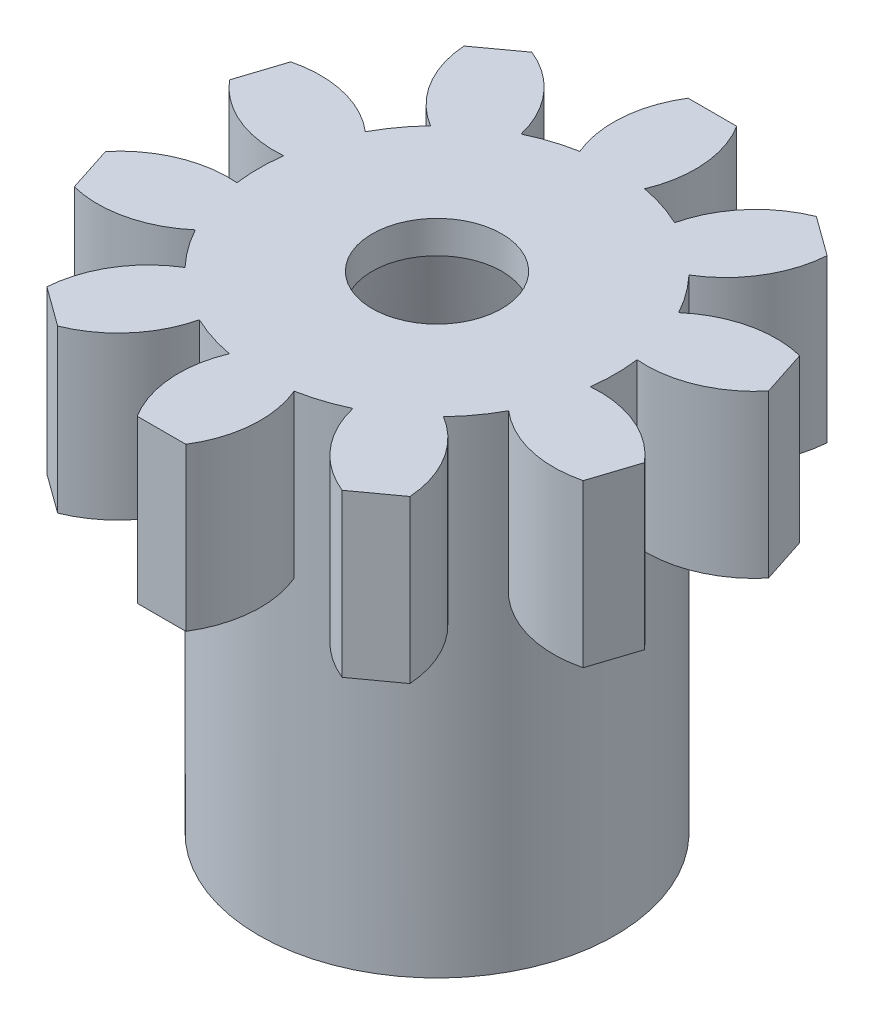
from build123d import *
from build123d.topology import SkipClean

# Parameters (mm, degrees)
SKETCH_1_R      = 5.5
EXTRUDE_1_DEPTH = 5
EXTRUDE_START   = -5
EXTRUDE_2_DEPTH = 5
EXTRUDE_START_2 = 10
SKETCH_3_R      = 5.5
EXTRUDE_3_DEPTH = 10


with BuildPart() as part:
    # 草图1 → 凸台-拉伸1 (new body)
    with BuildSketch(Plane(origin=(0, 0, 0), x_dir=(1, 0, 0), z_dir=(0, 1, 0))):
        with Locations(Location((0, 0, 0), (0, 0, 270))):
            Circle(SKETCH_1_R)
    extrude(amount=EXTRUDE_1_DEPTH)

    # 草图2 → 凸台-拉伸2 (add)
    with BuildSketch(Plane(origin=(0, 5, 0), x_dir=(-1, 0, 0), z_dir=(0, 1, 0)).offset(EXTRUDE_START)):
        with BuildLine():
            Line((-4.389411899, -7.317483391), (-5.60293739, -6.435805513))
            ThreePointArc((-5.60293739, -6.435805513), (-5.11774735, -4.915167527), (-3.987951794, -3.787643132))
            ThreePointArc((-3.987951794, -3.787643132), (-3.232818888, -4.449593469), (-2.369917805, -4.963213636))
            ThreePointArc((-2.369917805, -4.963213636), (-3.093131201, -6.386137262), (-4.389411899, -7.317483391))
        make_face()
        with BuildLine():
            Line((-7.852217643, -3.339936839), (-8.315743134, -1.913352065))
            ThreePointArc((-8.315743134, -1.913352065), (-7.029407564, -0.968317642), (-5.452641547, -0.720208411))
            ThreePointArc((-5.452641547, -0.720208411), (-5.23081084, -1.699593469), (-4.834607559, -2.622321444))
            ThreePointArc((-4.834607559, -2.622321444), (-6.256073009, -3.34839667), (-7.852217643, -3.339936839))
        make_face()
        with BuildLine():
            Line((-8.315743134, 1.913352065), (-7.852217643, 3.339936839))
            ThreePointArc((-7.852217643, 3.339936839), (-6.256073009, 3.34839667), (-4.834607559, 2.622321444))
            ThreePointArc((-4.834607559, 2.622321444), (-5.23081084, 1.699593469), (-5.452641547, 0.720208411))
            ThreePointArc((-5.452641547, 0.720208411), (-7.029407564, 0.968317642), (-8.315743134, 1.913352065))
        make_face()
        with BuildLine():
            Line((-5.60293739, 6.435805513), (-4.389411899, 7.317483391))
            ThreePointArc((-4.389411899, 7.317483391), (-3.093131201, 6.386137262), (-2.369917805, 4.963213636))
            ThreePointArc((-2.369917805, 4.963213636), (-3.232818888, 4.449593469), (-3.987951794, 3.787643132))
            ThreePointArc((-3.987951794, 3.787643132), (-5.11774735, 4.915167527), (-5.60293739, 6.435805513))
        make_face()
        with BuildLine():
            Line((-0.75, 8.5), (0.75, 8.5))
            ThreePointArc((0.75, 8.5), (1.251281594, 6.984590476), (1, 5.408326913))
            ThreePointArc((1, 5.408326913), (0, 5.5), (-1, 5.408326913))
            ThreePointArc((-1, 5.408326913), (-1.251281594, 6.984590476), (-0.75, 8.5))
        make_face()
        with BuildLine():
            Line((4.389411899, 7.317483391), (5.60293739, 6.435805513))
            ThreePointArc((5.60293739, 6.435805513), (5.11774735, 4.915167527), (3.987951794, 3.787643132))
            ThreePointArc((3.987951794, 3.787643132), (3.232818888, 4.449593469), (2.369917805, 4.963213636))
            ThreePointArc((2.369917805, 4.963213636), (3.093131201, 6.386137262), (4.389411899, 7.317483391))
        make_face()
        with BuildLine():
            Line((0.75, -8.5), (-0.75, -8.5))
            ThreePointArc((-0.75, -8.5), (-1.251281594, -6.984590476), (-1, -5.408326913))
            ThreePointArc((-1, -5.408326913), (0, -5.5), (1, -5.408326913))
            ThreePointArc((1, -5.408326913), (1.251281594, -6.984590476), (0.75, -8.5))
        make_face()
        with BuildLine():
            Line((7.852217643, 3.339936839), (8.315743134, 1.913352065))
            ThreePointArc((8.315743134, 1.913352065), (7.029407564, 0.968317642), (5.452641547, 0.720208411))
            ThreePointArc((5.452641547, 0.720208411), (5.23081084, 1.699593469), (4.834607559, 2.622321444))
            ThreePointArc((4.834607559, 2.622321444), (6.256073009, 3.34839667), (7.852217643, 3.339936839))
        make_face()
        with BuildLine():
            Line((8.315743134, -1.913352065), (7.852217643, -3.339936839))
            ThreePointArc((7.852217643, -3.339936839), (6.256073009, -3.34839667), (4.834607559, -2.622321444))
            ThreePointArc((4.834607559, -2.622321444), (5.23081084, -1.699593469), (5.452641547, -0.720208411))
            ThreePointArc((5.452641547, -0.720208411), (7.029407564, -0.968317642), (8.315743134, -1.913352065))
        make_face()
        with BuildLine():
            Line((5.60293739, -6.435805513), (4.389411899, -7.317483391))
            ThreePointArc((4.389411899, -7.317483391), (3.093131201, -6.386137262), (2.369917805, -4.963213636))
            ThreePointArc((2.369917805, -4.963213636), (3.232818888, -4.449593469), (3.987951794, -3.787643132))
            ThreePointArc((3.987951794, -3.787643132), (5.11774735, -4.915167527), (5.60293739, -6.435805513))
        make_face()
    extrude(amount=EXTRUDE_2_DEPTH)

    # 草图3 → 凸台-拉伸3 (add)
    with SkipClean():  # the faces are left unmerged after this step: merging them gives an invalid solid
        with BuildSketch(Plane.XZ.offset(EXTRUDE_START_2)):
            with Locations(Location((0, 0, 0), (0, 0, 270))):
                Circle(SKETCH_3_R)
        extrude(amount=-EXTRUDE_3_DEPTH)

    # 草图4 → 切除-旋转1 (revolve, cut)
    with SkipClean():  # the faces are left unmerged after this step: merging them gives an invalid solid
        with BuildSketch(Plane.XY, mode=Mode.PRIVATE) as cut_revolve_1_sk:
            Polygon((0, -10), (0, -3), (0, 4), (0, 5), (2, 5), (2, 4), (3, 4), (4.5, -3), (4.5, -10), align=None)
        revolve(cut_revolve_1_sk.sketch.rotate(Axis((0, -3, 0), (0, 1, 0)), 90), axis=Axis((0, -3, 0), (0, 1, 0)), mode=Mode.SUBTRACT)


solid = part.part
